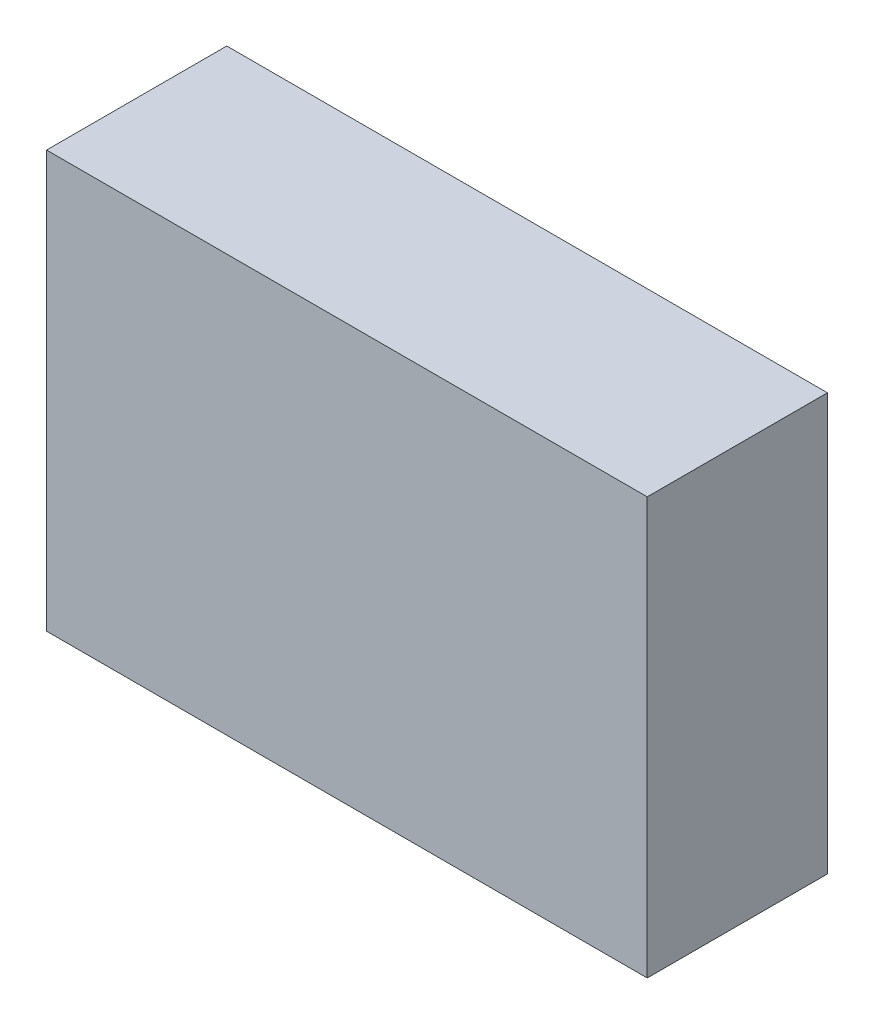
from build123d import *

# Parameters (mm, degrees)
SKETCH1_W           = 38.1
SKETCH1_H           = 88.10625
BOSS_EXTRUDE1_DEPTH = 127


with BuildPart() as part:
    # Sketch1 → Boss-Extrude1 (new body)
    with BuildSketch(Plane(origin=(0, 0, 0), x_dir=(0, 0, -1), z_dir=(1, 0, 0))):
        Rectangle(SKETCH1_W, SKETCH1_H)
    extrude(amount=BOSS_EXTRUDE1_DEPTH)


solid = part.part
